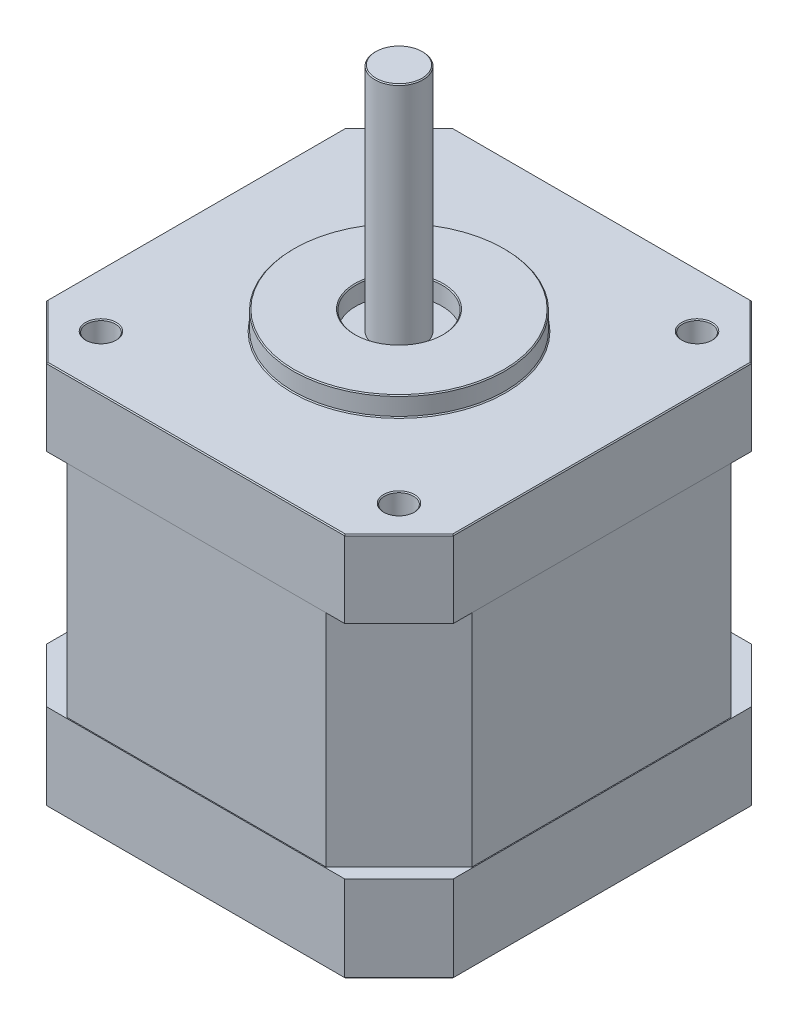
from build123d import *

# Parameters (mm, degrees)
SKETCH1_R           = 1.5
BOSS_EXTRUDE1_DEPTH = 9
SKETCH4_R           = 1.5
BOSS_EXTRUDE4_DEPTH = 23
SKETCH5_R           = 1.5
BOSS_EXTRUDE6_DEPTH = 8
SKETCH2_R           = 11
SKETCH2_R_2         = 4.5
BOSS_EXTRUDE2_DEPTH = 2
SKETCH3_R           = 2.5
BOSS_EXTRUDE3_DEPTH = 24
CHAMFER1_SIZE       = 0.1
CHAMFER2_SIZE       = 0.1


with BuildPart() as part:
    # Sketch1 → Boss-Extrude1 (new body)
    with BuildSketch(Plane(origin=(0, 0, 0), x_dir=(1, 0, 0), z_dir=(0, 1, 0))):
        Polygon((-15.5, -21.15), (15.5, -21.15), (21.15, -15.5), (21.15, 15.5), (15.5, 21.15), (-15.5, 21.15), (-21.15, 15.5), (-21.15, -15.5), align=None)
        with Locations(Location((-15.5, 15.5, 0), (0, 0, 270))):
            Circle(SKETCH1_R, mode=Mode.SUBTRACT)
        with Locations(Location((15.5, -15.5, 0), (0, 0, 90))):
            Circle(SKETCH1_R, mode=Mode.SUBTRACT)
        with Locations(Location((15.5, 15.5, 0), (0, 0, 270))):
            Circle(SKETCH1_R, mode=Mode.SUBTRACT)
        with Locations(Location((-15.5, -15.5, 0), (0, 0, 90))):
            Circle(SKETCH1_R, mode=Mode.SUBTRACT)
    extrude(amount=BOSS_EXTRUDE1_DEPTH)

    # Sketch4 → Boss-Extrude4 (add)
    with BuildSketch(Plane(origin=(0, 9, 0), x_dir=(1, 0, 0), z_dir=(0, 1, 0))):
        Polygon((13.478679656, 21.05), (-13.478679656, 21.05), (-21.05, 13.478679656), (-21.05, -13.478679656), (-13.478679656, -21.05), (13.478679656, -21.05), (21.05, -13.478679656), (21.05, 13.478679656), align=None)
        with Locations(Location((-15.5, 15.5, 0), (0, 0, 270))):
            Circle(SKETCH4_R, mode=Mode.SUBTRACT)
        with Locations(Location((15.5, 15.5, 0), (0, 0, 270))):
            Circle(SKETCH4_R, mode=Mode.SUBTRACT)
        with Locations(Location((15.5, -15.5, 0), (0, 0, 90))):
            Circle(SKETCH4_R, mode=Mode.SUBTRACT)
        with Locations(Location((-15.5, -15.5, 0), (0, 0, 90))):
            Circle(SKETCH4_R, mode=Mode.SUBTRACT)
    extrude(amount=BOSS_EXTRUDE4_DEPTH)

    # Sketch5 → Boss-Extrude6 (add)
    with BuildSketch(Plane(origin=(0, 32, 0), x_dir=(1, 0, 0), z_dir=(0, 1, 0))):
        Polygon((-15.5, 21.15), (-21.15, 15.5), (-21.15, -15.5), (-15.5, -21.15), (15.5, -21.15), (21.15, -15.5), (21.15, 15.5), (15.5, 21.15), align=None)
        with Locations(Location((15.5, 15.5, 0), (0, 0, 270))):
            Circle(SKETCH5_R, mode=Mode.SUBTRACT)
        with Locations(Location((-15.5, 15.5, 0), (0, 0, 270))):
            Circle(SKETCH5_R, mode=Mode.SUBTRACT)
        with Locations(Location((-15.5, -15.5, 0), (0, 0, 90))):
            Circle(SKETCH5_R, mode=Mode.SUBTRACT)
        with Locations(Location((15.5, -15.5, 0), (0, 0, 90))):
            Circle(SKETCH5_R, mode=Mode.SUBTRACT)
    extrude(amount=BOSS_EXTRUDE6_DEPTH)

    # Sketch2 → Boss-Extrude2 (add)
    with BuildSketch(Plane(origin=(0, 40, 0), x_dir=(1, 0, 0), z_dir=(0, 1, 0))):
        with Locations(Location((0, 0, 0), (0, 0, 270))):
            Circle(SKETCH2_R)
        with Locations(Location((0, 0, 0), (0, 0, 270))):
            Circle(SKETCH2_R_2, mode=Mode.SUBTRACT)
    extrude(amount=BOSS_EXTRUDE2_DEPTH)

    # Chamfer1
    chamfer1_edges = [part.edges().sort_by_distance(p)[0] for p in [
        (-21.15, 0, 0),
        (-18.325, 0, -18.325),
        (0, 42, -11),
        (0, 40, -11),
        (0, 42, -4.5),
        (-15.5, 0, -17),
        (15.5, 0, 17),
        (15.5, 0, -17),
        (-15.5, 0, 17),
        (0, 40, -21.15),
        (-18.325, 40, -18.325),
        (-21.15, 40, 0),
        (-18.325, 40, 18.325),
        (0, 40, 21.15),
        (18.325, 40, 18.325),
        (21.15, 40, 0),
        (18.325, 40, -18.325),
        (0, 0, -21.15),
        (15.5, 40, -17),
        (18.325, 0, -18.325),
        (-15.5, 40, -17),
        (-15.5, 40, 17),
        (15.5, 40, 17),
        (21.15, 0, 0),
        (18.325, 0, 18.325),
        (0, 0, 21.15),
        (-18.325, 0, 18.325),
    ]]
    chamfer(chamfer1_edges, length=CHAMFER1_SIZE)


with BuildPart() as body_2:
    # Sketch3 → Boss-Extrude3 (new body)
    with BuildSketch(Plane(origin=(0, 40, 0), x_dir=(1, 0, 0), z_dir=(0, 1, 0))):
        with Locations(Location((0, 0, 0), (0, 0, 270))):
            Circle(SKETCH3_R)
    extrude(amount=BOSS_EXTRUDE3_DEPTH)

    # Chamfer2
    chamfer2_edges = [body_2.edges().sort_by_distance(p)[0] for p in [
        (0, 64, -2.5),
    ]]
    chamfer(chamfer2_edges, length=CHAMFER2_SIZE)


solid = Compound([part.part, body_2.part])
